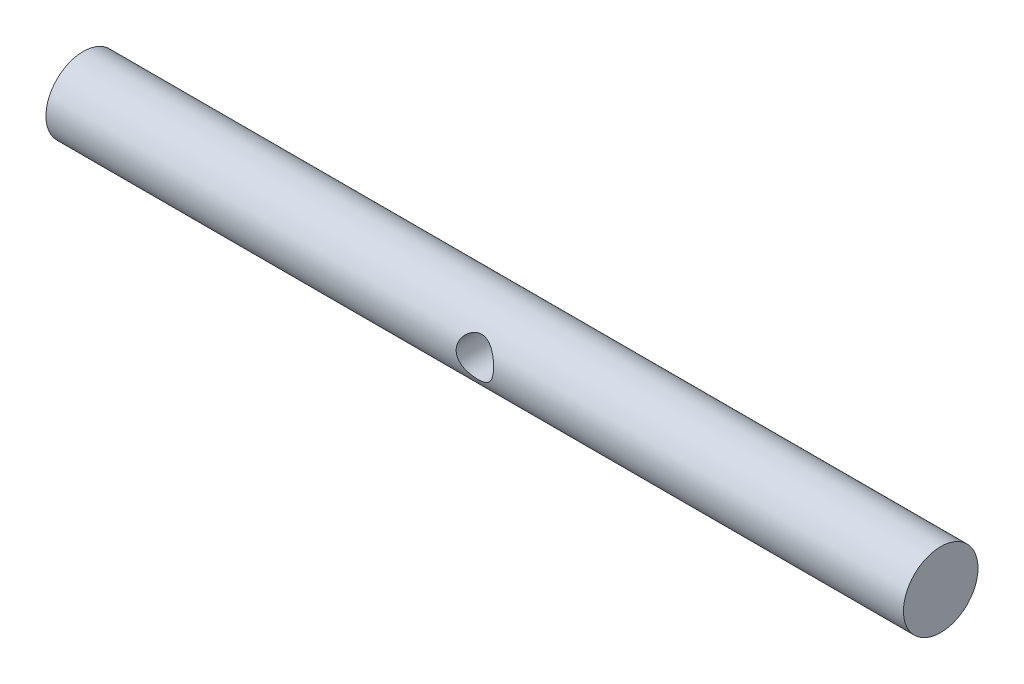
from build123d import *

# Parameters (mm, degrees)
SKETCH_1_R               = 12.7
EXTRUDE_1_DEPTH          = 292.1
CUT_EXTRUDE_1_DEPTH      = 293.651652994
CUT_EXTRUDE_1_DEPTH_BACK = 293.651652994
SKETCH_2_R               = 6.35


with BuildPart() as part:
    # 草图1 → 凸台-拉伸1 (new body)
    with BuildSketch(Plane(origin=(0, 0, 0), x_dir=(0, 0, -1), z_dir=(1, 0, 0))):
        Circle(SKETCH_1_R)
    extrude(amount=EXTRUDE_1_DEPTH)

    # 草图2 → 切除-拉伸1 (cut, two sides: drawn at the far end of the back side and taken through both)
    with BuildSketch(Plane.XY.offset(-CUT_EXTRUDE_1_DEPTH_BACK)):
        with Locations(Location((146.05, 1.085382152, 0), (0, 0, 180))):
            Circle(SKETCH_2_R)
    extrude(amount=CUT_EXTRUDE_1_DEPTH + CUT_EXTRUDE_1_DEPTH_BACK, mode=Mode.SUBTRACT)


solid = part.part
